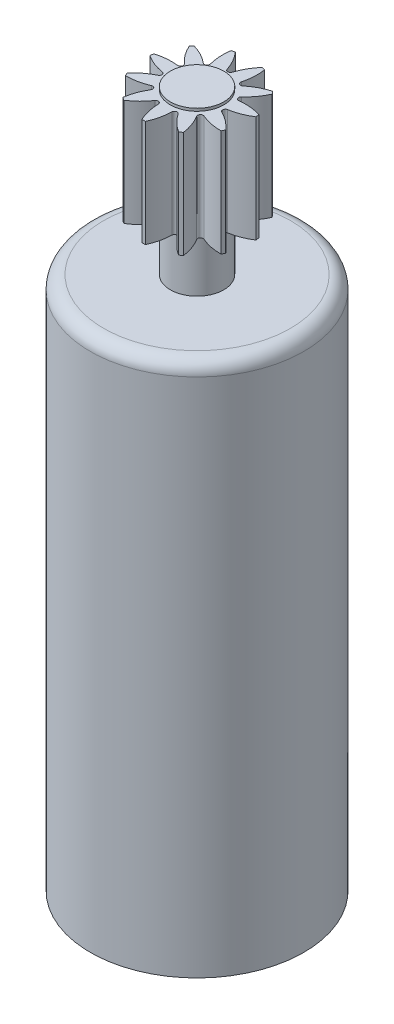
from build123d import *

# Parameters (mm, degrees)
CUT_EXTRUDE_START        = -4
CUT_EXTRUDE_1_DEPTH      = 4
PATTERN_CIRCULAR_1_COUNT = 11


with BuildPart() as part:
    # 草图1 → 旋转1 (revolve)
    with BuildSketch(Plane.XY, mode=Mode.PRIVATE) as revolve_1_sk:
        with BuildLine():
            Line((0, 0), (0, 26.1))
            Line((0, 26.1), (1, 26.1))
            Line((1, 26.1), (1, 26))
            Line((1, 26), (2, 26))
            Line((2, 26), (2, 22))
            Line((2, 22), (1, 22))
            Line((1, 22), (1, 20))
            Line((1, 20), (3.5, 20))
            ThreePointArc((3.5, 20), (3.853553391, 19.853553391), (4, 19.5))
            Line((4, 19.5), (4, 0))
            Line((4, 0), (0, 0))
        make_face()
    revolve(revolve_1_sk.sketch.rotate(Axis((0, 0, 0), (0, 1, 0)), 90), axis=Axis((0, 0, 0), (0, 1, 0)))

    # 草图2 → 切除-拉伸1 (cut)
    with BuildSketch(Plane(origin=(0, 26, 0), x_dir=(1, 0, 0), z_dir=(0, 1, 0)).offset(CUT_EXTRUDE_START)):
        with BuildLine():
            Line((0, 2), (0, 1.15))
            ThreePointArc((0, 1.15), (0.059077059, 1.169316042), (0.095331419, 1.219801979))
            ThreePointArc((0.095331419, 1.219801979), (0.260400333, 1.599188187), (0.5, 1.936491673))
            ThreePointArc((0.5, 1.936491673), (0.252008585, 1.984059393), (0, 2))
        make_face()
        with BuildLine():
            ThreePointArc((-0.095331419, 1.219801979), (-0.059077059, 1.169316042), (0, 1.15))
            Line((0, 1.15), (0, 2))
            ThreePointArc((0, 2), (-0.252008585, 1.984059393), (-0.5, 1.936491673))
            ThreePointArc((-0.5, 1.936491673), (-0.260400333, 1.599188187), (-0.095331419, 1.219801979))
        make_face()
    cut_extrude_1 = extrude(amount=CUT_EXTRUDE_1_DEPTH, mode=Mode.SUBTRACT)

    # 阵列(圆周)1: 切除-拉伸1 ×11 about axis
    pattern_circular_1_axis = Axis((0, 0, 0), (0, 1, 0))
    for i in range(1, PATTERN_CIRCULAR_1_COUNT):
        add(cut_extrude_1.rotate(pattern_circular_1_axis, i * 360 / PATTERN_CIRCULAR_1_COUNT), mode=Mode.SUBTRACT)


solid = part.part
